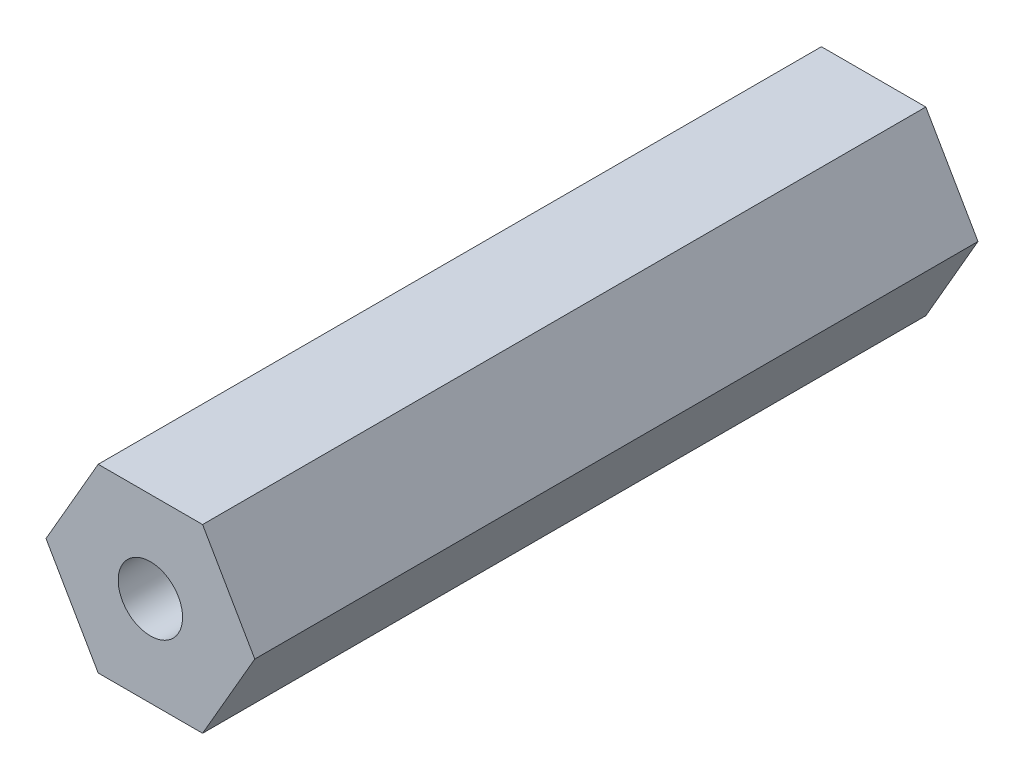
from build123d import *

# Parameters (mm, degrees)
EXTRUDE1_DEPTH            = 25.4
F_4_40_TAPPED_HOLE1_D     = 2.2606
F_4_40_TAPPED_HOLE1_DEPTH = 7.5946
F_4_40_TAPPED_HOLE1_TIP   = 0.679152758
F_4_40_TAPPED_HOLE2_D     = 2.2606
F_4_40_TAPPED_HOLE2_DEPTH = 7.5946
F_4_40_TAPPED_HOLE2_TIP   = 0.679152758


with BuildPart() as part:
    # Sketch2 → Extrude1 (new body)
    with BuildSketch(Plane.XY):
        Polygon((-1.833087105, 3.175), (1.833087105, 3.175), (3.666174209, 0), (1.833087105, -3.175), (-1.833087105, -3.175), (-3.666174209, 0), align=None)
    extrude(amount=-EXTRUDE1_DEPTH)

    # #4-40 Tapped Hole1
    with Locations(Plane.XY):
        with Locations((0, 0)):
            Hole(F_4_40_TAPPED_HOLE1_D / 2, depth=F_4_40_TAPPED_HOLE1_DEPTH)
            with Locations((0, 0, -(F_4_40_TAPPED_HOLE1_DEPTH + F_4_40_TAPPED_HOLE1_TIP / 2))):  # 118° drill point
                Cone(0, F_4_40_TAPPED_HOLE1_D / 2, F_4_40_TAPPED_HOLE1_TIP, mode=Mode.SUBTRACT)

    # #4-40 Tapped Hole2
    with Locations(Plane(origin=(0, 0, -25.4), x_dir=(-1, 0, 0), z_dir=(0, 0, -1))):
        with Locations((0, 0)):
            Hole(F_4_40_TAPPED_HOLE2_D / 2, depth=F_4_40_TAPPED_HOLE2_DEPTH)
            with Locations((0, 0, -(F_4_40_TAPPED_HOLE2_DEPTH + F_4_40_TAPPED_HOLE2_TIP / 2))):  # 118° drill point
                Cone(0, F_4_40_TAPPED_HOLE2_D / 2, F_4_40_TAPPED_HOLE2_TIP, mode=Mode.SUBTRACT)


solid = part.part
